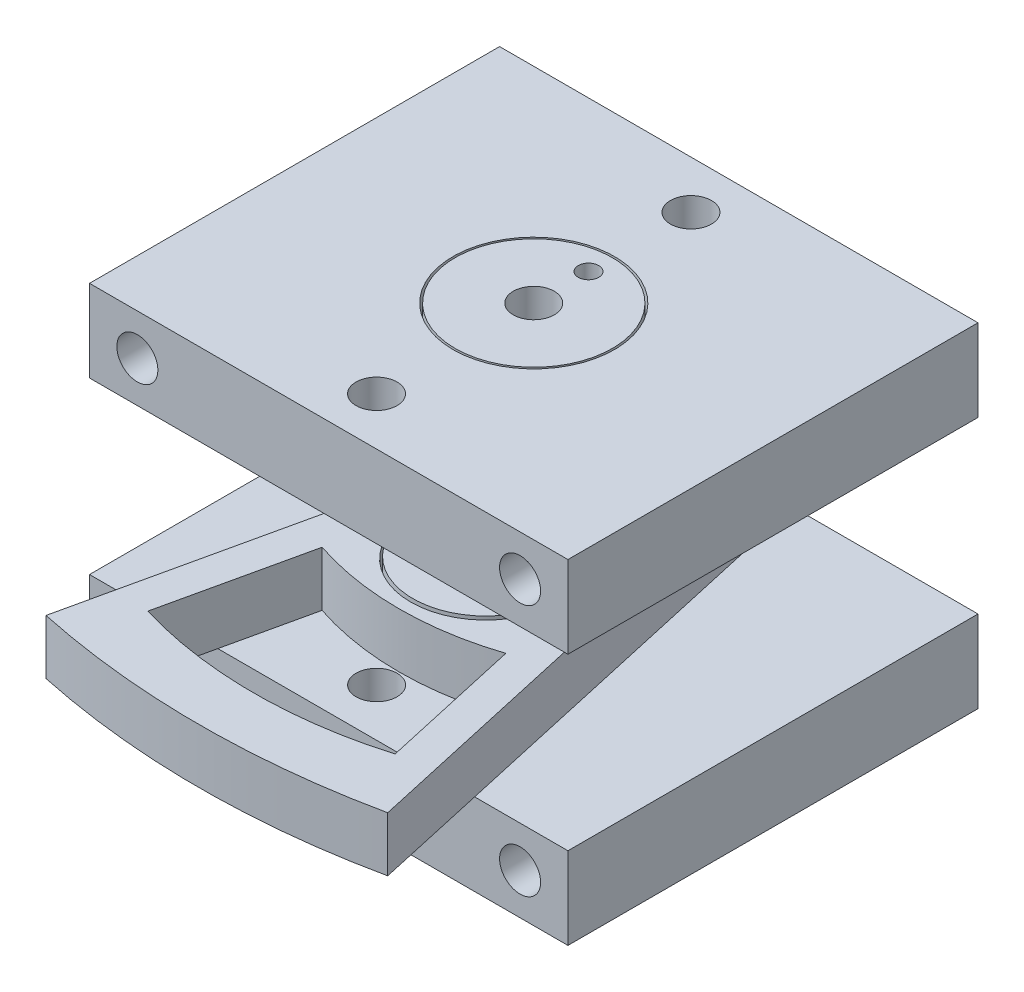
from build123d import *

# Parameters (mm, degrees)
SKETCH6_R               = 5.35
SKETCH6_R_2             = 0.75
SKETCH6_R_3             = 1.5
BOSS_EXTRUDE2_DEPTH     = 4.15
BOSS_EXTRUDE3_START     = 4.15
SKETCH6_3_R             = 5.35
SKETCH6_3_R_2           = 0.75
SKETCH6_3_R_3           = 1.5
BOSS_EXTRUDE3_DEPTH     = 4.15
BOSS_EXTRUDE4_START     = 8.3
SKETCH6_4_R             = 5.35
SKETCH6_4_R_2           = 0.75
SKETCH6_4_R_3           = 1.5
BOSS_EXTRUDE4_DEPTH     = 4.15
SKETCH2_R               = 5.5
BOSS_EXTRUDE1_DEPTH     = 4
SKETCH7_W               = 35
SKETCH7_H               = 30
SKETCH7_R               = 5.904257245
SKETCH7_R_2             = 1.5
BOSS_EXTRUDE5_DEPTH     = 6
BOSS_EXTRUDE6_START     = 12.45
SKETCH7_2_W             = 35
SKETCH7_2_H             = 30
SKETCH7_2_R             = 5.904257245
SKETCH7_2_R_2           = 1.5
BOSS_EXTRUDE6_DEPTH     = 6
SKETCH7_4_R             = 5.754257245
SKETCH7_4_R_2           = 0.75
SKETCH7_4_R_3           = 1.5
BOSS_EXTRUDE7_DEPTH     = 6
BOSS_EXTRUDE8_START     = 12.45
SKETCH7_5_R             = 5.754257245
SKETCH7_5_R_2           = 0.75
SKETCH7_5_R_3           = 1.5
BOSS_EXTRUDE8_DEPTH     = 6
CUT_EXTRUDE2_DEPTH      = 47.977680871
CUT_EXTRUDE2_DEPTH_BACK = 47.977680871
SKETCH9_R               = 1.5


with BuildPart() as part:
    # Sketch6 → Boss-Extrude2 (new body)
    with BuildSketch(Plane(origin=(0, 0, 0), x_dir=(1, 0, 0), z_dir=(0, 1, 0))):
        with Locations(Location((0, -3.5, 0), (0, 0, 90))):
            Circle(SKETCH6_R)
        with Locations(Location((-3.467788497, -2.002128622, 0), (0, 0, 90))):
            Circle(SKETCH6_R_2, mode=Mode.SUBTRACT)
        with Locations(Location((0, 0, 0), (0, 0, 90))):
            Circle(SKETCH6_R_3, mode=Mode.SUBTRACT)
    extrude(amount=BOSS_EXTRUDE2_DEPTH)


with BuildPart() as body_2:
    # Sketch6<3> → Boss-Extrude3 (new body)
    with BuildSketch(Plane(origin=(0, 0, 0), x_dir=(1, 0, 0), z_dir=(0, 1, 0)).offset(BOSS_EXTRUDE3_START)):
        with Locations(Location((-3.031088913, 1.75, 0), (0, 0, 90))):
            Circle(SKETCH6_3_R)
        with Locations(Location((0, 4.004257245, 0), (0, 0, 90))):
            Circle(SKETCH6_3_R_2, mode=Mode.SUBTRACT)
        with Locations(Location((-3.467788497, -2.002128622, 0), (0, 0, 90))):
            Circle(SKETCH6_3_R_2, mode=Mode.SUBTRACT)
        with Locations(Location((0, 0, 0), (0, 0, 90))):
            Circle(SKETCH6_3_R_3, mode=Mode.SUBTRACT)
    extrude(amount=BOSS_EXTRUDE3_DEPTH)


with BuildPart() as body_3:
    # Sketch6<4> → Boss-Extrude4 (new body)
    with BuildSketch(Plane(origin=(0, 0, 0), x_dir=(1, 0, 0), z_dir=(0, 1, 0)).offset(BOSS_EXTRUDE4_START)):
        with Locations(Location((3.031088913, 1.75, 0), (0, 0, 90))):
            Circle(SKETCH6_4_R)
        with Locations(Location((0, 4.004257245, 0), (0, 0, 90))):
            Circle(SKETCH6_4_R_2, mode=Mode.SUBTRACT)
        with Locations(Location((0, 0, 0), (0, 0, 90))):
            Circle(SKETCH6_4_R_3, mode=Mode.SUBTRACT)
    extrude(amount=BOSS_EXTRUDE4_DEPTH)


with BuildPart() as body_4:
    # Sketch2 → Boss-Extrude1 (new body)
    with BuildSketch(Plane(origin=(0, 0, 0), x_dir=(1, 0, 0), z_dir=(0, 1, 0))):
        with BuildLine():
            Line((-4.5384841, 12.512255932), (-12.5, -23.183472972))
            ThreePointArc((-12.5, -23.183472972), (0, -24.5), (12.5, -23.183472972))
            Line((12.5, -23.183472972), (4.5384841, 12.512255932))
            ThreePointArc((4.5384841, 12.512255932), (0, 16.15), (-4.5384841, 12.512255932))
        make_face()
        with Locations(Location((0, -3.5, 0), (0, 0, 270))):
            Circle(SKETCH2_R, mode=Mode.SUBTRACT)
        with BuildLine():
            Line((-1.65, 4.5), (-1.65, 11.5))
            ThreePointArc((-1.65, 11.5), (0, 13.15), (1.65, 11.5))
            Line((1.65, 11.5), (1.65, 4.5))
            ThreePointArc((1.65, 4.5), (0, 2.85), (-1.65, 4.5))
        make_face(mode=Mode.SUBTRACT)
        with BuildLine():
            Line((6.722482513, -8.764025485), (9.048760467, -19.193972275))
            ThreePointArc((9.048760467, -19.193972275), (0, -20.5), (-9.048760467, -19.193972275))
            Line((-9.048760467, -19.193972275), (-6.722482513, -8.764025485))
            ThreePointArc((-6.722482513, -8.764025485), (0, -9.85), (6.722482513, -8.764025485))
        make_face(mode=Mode.SUBTRACT)
    extrude(amount=BOSS_EXTRUDE1_DEPTH)


with BuildPart() as body_5:
    # Sketch7 → Boss-Extrude5 (new body)
    with BuildSketch(Plane(origin=(0, 0, 0), x_dir=(1, 0, 0), z_dir=(0, 1, 0))):
        Rectangle(SKETCH7_W, SKETCH7_H)
        with Locations(Location((0, 0, 0), (0, 0, 270))):
            Circle(SKETCH7_R, mode=Mode.SUBTRACT)
        with Locations(Location((0, 11.5, 0), (0, 0, 270))):
            Circle(SKETCH7_R_2, mode=Mode.SUBTRACT)
        with Locations(Location((0, -11.5, 0), (0, 0, 270))):
            Circle(SKETCH7_R_2, mode=Mode.SUBTRACT)
    extrude(amount=-BOSS_EXTRUDE5_DEPTH)


with BuildPart() as body_6:
    # Sketch7<2> → Boss-Extrude6 (new body)
    with BuildSketch(Plane(origin=(0, 0, 0), x_dir=(1, 0, 0), z_dir=(0, 1, 0)).offset(BOSS_EXTRUDE6_START)):
        Rectangle(SKETCH7_2_W, SKETCH7_2_H)
        with Locations(Location((0, 0, 0), (0, 0, 270))):
            Circle(SKETCH7_2_R, mode=Mode.SUBTRACT)
        with Locations(Location((0, 11.5, 0), (0, 0, 270))):
            Circle(SKETCH7_2_R_2, mode=Mode.SUBTRACT)
        with Locations(Location((0, -11.5, 0), (0, 0, 270))):
            Circle(SKETCH7_2_R_2, mode=Mode.SUBTRACT)
    extrude(amount=BOSS_EXTRUDE6_DEPTH)


with BuildPart() as body_7:
    # Sketch7<4> → Boss-Extrude7 (new body)
    with BuildSketch(Plane(origin=(0, 0, 0), x_dir=(1, 0, 0), z_dir=(0, 1, 0))):
        with Locations(Location((0, 0, 0), (0, 0, 270))):
            Circle(SKETCH7_4_R)
        with Locations(Location((0, 4.004257245, 0), (0, 0, 270))):
            Circle(SKETCH7_4_R_2, mode=Mode.SUBTRACT)
        with Locations(Location((0, 0, 0), (0, 0, 270))):
            Circle(SKETCH7_4_R_3, mode=Mode.SUBTRACT)
    extrude(amount=-BOSS_EXTRUDE7_DEPTH)


with BuildPart() as body_8:
    # Sketch7<5> → Boss-Extrude8 (new body)
    with BuildSketch(Plane(origin=(0, 0, 0), x_dir=(1, 0, 0), z_dir=(0, 1, 0)).offset(BOSS_EXTRUDE8_START)):
        with Locations(Location((0, 0, 0), (0, 0, 270))):
            Circle(SKETCH7_5_R)
        with Locations(Location((0, 4.004257245, 0), (0, 0, 270))):
            Circle(SKETCH7_5_R_2, mode=Mode.SUBTRACT)
        with Locations(Location((0, 0, 0), (0, 0, 270))):
            Circle(SKETCH7_5_R_3, mode=Mode.SUBTRACT)
    extrude(amount=BOSS_EXTRUDE8_DEPTH)


with BuildPart() as cut_extrude2_tool:
    # Sketch9 → Cut-Extrude2 (new, two sides: drawn at the far end of the back side and taken through both)
    with BuildSketch(Plane(origin=(0, 0, -15), x_dir=(-1, 0, 0), z_dir=(0, 0, -1)).offset(-CUT_EXTRUDE2_DEPTH_BACK)):
        with Locations((-14, 15.45)):
            Circle(SKETCH9_R)
        with Locations((14, 15.45)):
            Circle(SKETCH9_R)
        with Locations((14, -3)):
            Circle(SKETCH9_R)
        with Locations((-14, -3)):
            Circle(SKETCH9_R)
    extrude(amount=CUT_EXTRUDE2_DEPTH + CUT_EXTRUDE2_DEPTH_BACK)


with BuildPart() as body_5_1:
    add(body_5.part)

    # Cut-Extrude2: cut by cut_extrude2_tool
    add(cut_extrude2_tool.part, mode=Mode.SUBTRACT)


with BuildPart() as body_6_1:
    add(body_6.part)

    # Cut-Extrude2: cut by cut_extrude2_tool
    add(cut_extrude2_tool.part, mode=Mode.SUBTRACT)


solid = Compound([part.part, body_2.part, body_3.part, body_4.part, body_7.part, body_8.part, body_5_1.part, body_6_1.part])
